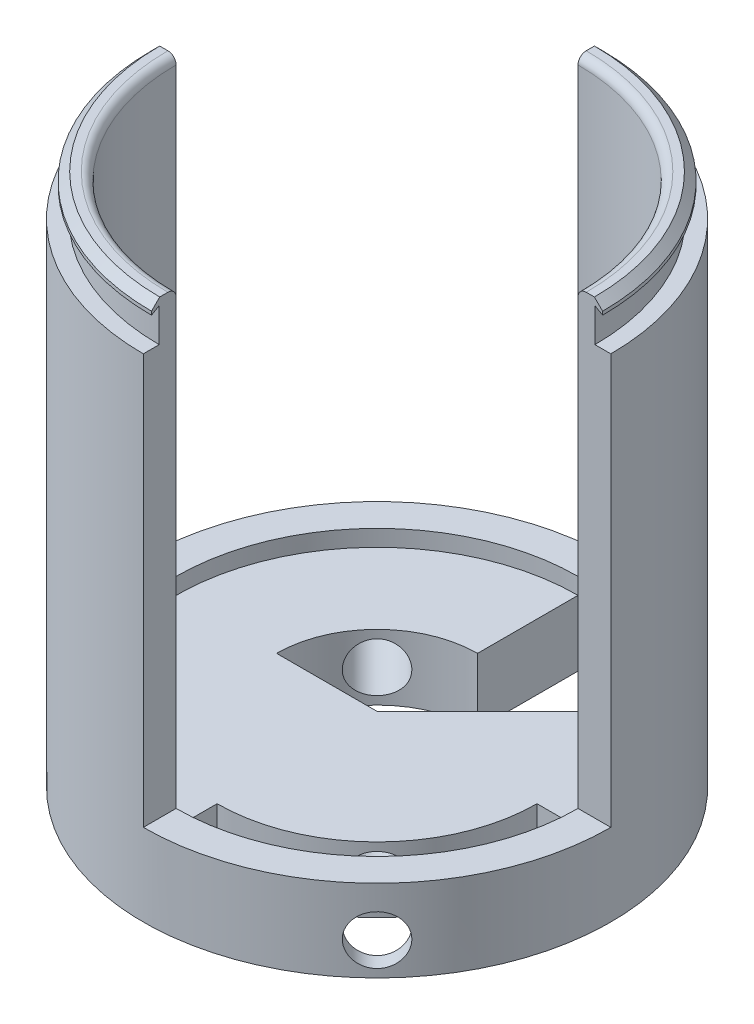
from build123d import *
from build123d.topology import SkipClean

# Parameters (mm, degrees)
SKETCH2_W          = 35
SKETCH2_H          = 74.99999999999999
CUT_EXTRUDE1_DEPTH = 48.000000000000014
CUT_EXTRUDE2_DEPTH = 48.000000000000014
CUT_EXTRUDE3_DEPTH = 48.000000000000014
SKETCH5_R          = 3
CUT_EXTRUDE4_DEPTH = 118
CUT_EXTRUDE5_DEPTH = 118


with BuildPart() as part:
    # Sketch1 → Revolve1 (revolve)
    with BuildSketch(Plane(origin=(0, 0, 0), x_dir=(0, 0, -1), z_dir=(1, 0, 0)), mode=Mode.PRIVATE) as revolve1_sk:
        with BuildLine():
            ThreePointArc((-24.50000000310361, 3.9999999999999964), (-24.792893221917062, 4.707106781186542), (-25.500000003103608, 4.9999999999999964))
            Line((-25.500000003103608, 4.9999999999999964), (-26.50000000000001, 4.9999999999999964))
            Line((-26.50000000000001, 4.9999999999999964), (-27.500000000000007, 3.9999999999999765))
            Line((-27.500000000000007, 3.9999999999999765), (-27.500000000000007, 3.5773502691895764))
            Line((-27.500000000000007, 3.5773502691895764), (-26.563508329999998, 4.11803398695792))
            Line((-26.563508329999998, 4.11803398695792), (-26.563508329999998, -3.49e-15))
            Line((-26.563508329999998, -3.49e-15), (-28.5, 0))
            Line((-28.5, 0), (-28.5, 7.158139534883724))
            Line((-28.5, 7.158139534883724), (-28.5, 60))
            Line((-28.5, 60), (-26.56350832689629, 59.99999999999999))
            Line((-26.56350832689629, 59.99999999999999), (-26.563508326896336, 64.11803398874981))
            Line((-26.563508326896336, 64.11803398874981), (-27.500000000000004, 63.577350269189594))
            Line((-27.500000000000004, 63.577350269189594), (-27.500000000000036, 64))
            Line((-27.500000000000036, 64), (-26.500000000000032, 64.99999999999999))
            Line((-26.500000000000032, 64.99999999999999), (-25.500000000000007, 64.99999999999999))
            ThreePointArc((-25.500000000000007, 64.99999999999999), (-24.792893218813454, 64.70710678118654), (-24.5, 63.999999999999986))
            Line((-24.5, 63.999999999999986), (-24.5, 59.99999999999999))
            Line((-24.5, 59.99999999999999), (-24.5, 7.9999999999999964))
            Line((-24.5, 7.9999999999999964), (0, 8))
            Line((0, 8), (0, 0))
            Line((0, 0), (-24.50000000310361, 2.49e-15))
            Line((-24.50000000310361, 2.49e-15), (-24.50000000310361, 3.9999999999999964))
        make_face()
    revolve(revolve1_sk.sketch.rotate(Axis((0, 0, 0), (0, 1, 0)), 180), axis=Axis((0, 0, 0), (0, 1, 0)))

    # Sketch2 → Cut-Extrude1 (cut)
    with BuildSketch(Plane.XY):
        with Locations((-17.5, 47.49999999999999)):
            Rectangle(SKETCH2_W, SKETCH2_H)
    extrude(amount=-CUT_EXTRUDE1_DEPTH, mode=Mode.SUBTRACT)

    # Sketch3 → Cut-Extrude2 (cut)
    with BuildSketch(Plane(origin=(0, 0, 0), x_dir=(-1, 0, 0), z_dir=(0, 0, -1))):
        Polygon((0, 9.999999999999995), (-35, 9.999999999999993), (-35, 69.99999999999999), (0, 69.99999999999999), align=None)
    extrude(amount=-CUT_EXTRUDE2_DEPTH, mode=Mode.SUBTRACT)

    # Sketch4 → Cut-Extrude3 (cut)
    with SkipClean():  # the faces are left unmerged after this step: merging them gives an invalid solid
        with BuildSketch(Plane(origin=(0, 7.999999999999998, 0), x_dir=(1, 0, 0), z_dir=(0, 1, 0))):
            with BuildLine():
                Line((24.5, 0), (19.5, 0))
                ThreePointArc((19.5, 0), (13.788582233137676, -13.788582233137678), (1.08e-15, -19.5))
                Line((0, -19.5), (0, -24.5))
                ThreePointArc((0, -24.5), (17.324116139070412, -17.324116139070412), (24.5, -7.05e-15))
            make_face()
        extrude(amount=-CUT_EXTRUDE3_DEPTH, mode=Mode.SUBTRACT)

    # Sketch5 → Cut-Extrude4 (cut)
    with SkipClean():  # the faces are left unmerged after this step: merging them gives an invalid solid
        with BuildSketch(Plane(origin=(20.152543263816604, 9.999999999999993, 20.152543263816604), x_dir=(0.7071067811865475, 0, -0.7071067811865476), z_dir=(0.7071067811865476, 0, 0.7071067811865475))):
            with Locations((-1.73e-15, -6)):
                Circle(SKETCH5_R)
        extrude(amount=-CUT_EXTRUDE4_DEPTH, mode=Mode.SUBTRACT)

    # Sketch6 → Cut-Extrude5 (cut)
    with BuildSketch(Plane(origin=(0, 7.999999999999998, 0), x_dir=(1, 0, 0), z_dir=(0, 1, 0))):
        with BuildLine():
            ThreePointArc((-8.66205806953527, 8.662058069535146), (-11.317524273263297, 4.687872046472272), (-12.25, -8.554e-14))
            Line((-12.25, -8.554e-14), (0, 0))
            Line((0, 0), (8.662058069535147, 8.662058069535266))
            ThreePointArc((8.662058069535147, 8.662058069535268), (4.687872046472274, 11.317524273263297), (-8.501e-14, 12.250000000000002))
            ThreePointArc((-8.501e-14, 12.250000000000002), (-4.687872046472431, 11.317524273263231), (-8.66205806953527, 8.662058069535146))
        make_face()
        with BuildLine():
            ThreePointArc((17.324116139070295, 17.324116139070526), (9.375744092944545, 22.635048546526583), (-1.7108e-13, 24.5))
            Line((-1.7108e-13, 24.5), (-8.554e-14, 12.25))
            ThreePointArc((-8.501e-14, 12.250000000000002), (4.687872046472274, 11.317524273263297), (8.662058069535147, 8.662058069535268))
            Line((8.662058069535147, 8.662058069535266), (17.324116139070295, 17.324116139070533))
        make_face()
    extrude(amount=-CUT_EXTRUDE5_DEPTH, mode=Mode.SUBTRACT)


solid = part.part
